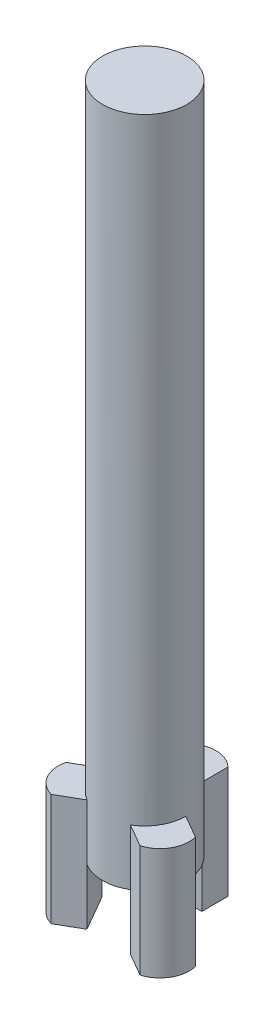
from build123d import *

# Parameters (mm, degrees)
BOSS_EXTRU_1_START           = 10
ESQUISSE1_R                  = 7.5
BOSS_EXTRU_1_DEPTH           = 120
BOSS_EXTRU_2_START           = 10
BOSS_EXTRU_2_DEPTH           = 20
R_P_TITION_CIRCULAIRE1_COUNT = 3


with BuildPart() as part:
    # Esquisse1 → Boss.-Extru.1 (new body)
    with BuildSketch(Plane(origin=(0, 0, 0), x_dir=(1, 0, 0), z_dir=(0, 1, 0)).offset(BOSS_EXTRU_1_START)):
        with Locations(Location((0, 0, 0), (0, 0, 90))):
            Circle(ESQUISSE1_R)
    extrude(amount=BOSS_EXTRU_1_DEPTH)

    # Esquisse3 → Boss.-Extru.2 (add)
    with BuildSketch(Plane.XZ.offset(-10).offset(BOSS_EXTRU_2_START)):
        with BuildLine():
            Line((3.621916752, -6.567474327), (-3.621916752, -6.567474327))
            Line((-3.621916752, -6.567474327), (-3.621916752, -11.25))
            ThreePointArc((-3.621916752, -11.25), (0, -12.713519057), (3.621916752, -11.25))
            Line((3.621916752, -11.25), (3.621916752, -6.567474327))
        make_face()
    boss_extru_2 = extrude(amount=-BOSS_EXTRU_2_DEPTH)

    # Répétition circulaire1: Boss.-Extru.2 ×3 about axis
    r_p_tition_circulaire1_axis = Axis((0, 0, 0), (0, 1, 0))
    for i in range(1, R_P_TITION_CIRCULAIRE1_COUNT):
        add(boss_extru_2.rotate(r_p_tition_circulaire1_axis, i * 360 / R_P_TITION_CIRCULAIRE1_COUNT))


solid = part.part
